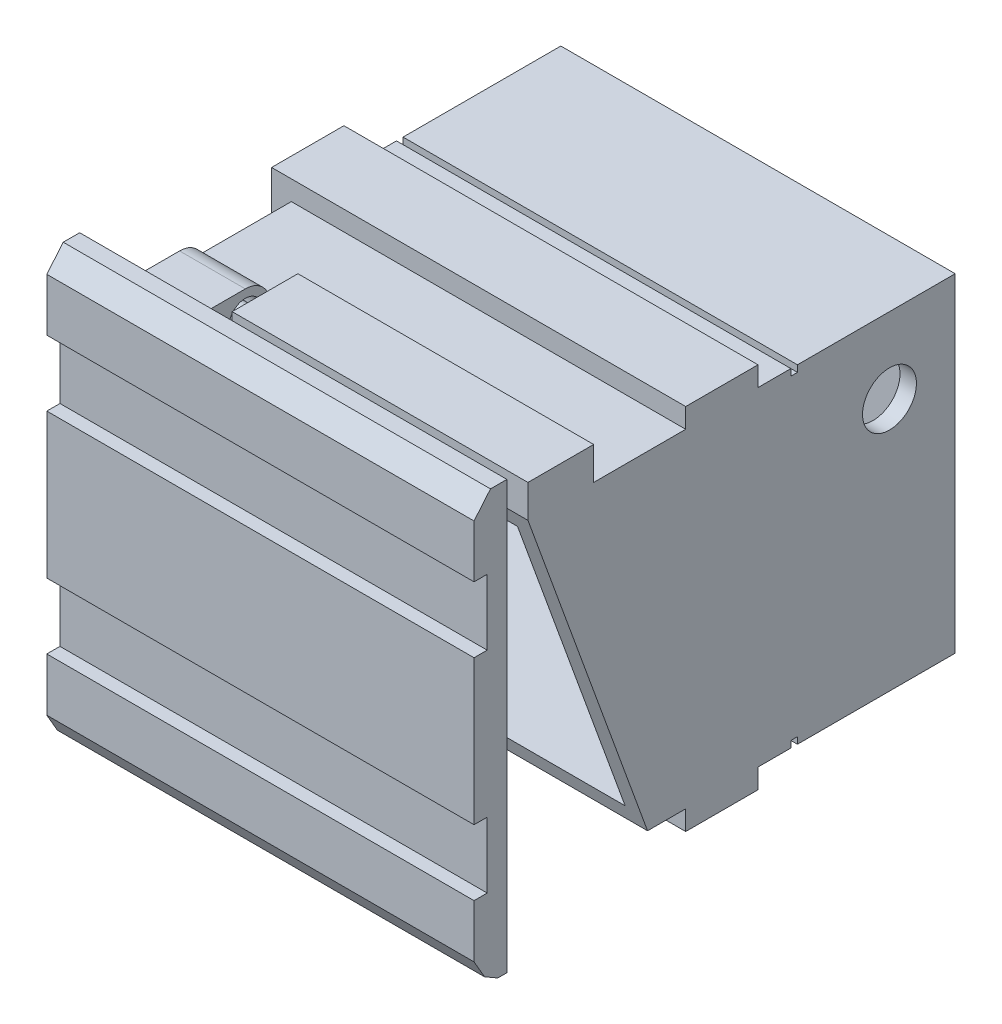
from build123d import *

# Parameters (mm, degrees)
CROQUIS2_W               = 60
CROQUIS2_H               = 50
SALIENTE_EXTRUIR2_DEPTH  = 5
CROQUIS3_W               = 60
CROQUIS3_H               = 50
CROQUIS3_W_2             = 55
CROQUIS3_H_2             = 45
SALIENTE_EXTRUIR3_DEPTH  = 60
CROQUIS4_R               = 4.1
CORTAR_EXTRUIR2_DEPTH    = 5
CORTAR_EXTRUIR3_DEPTH    = 92.923881554
CROQUIS18_W              = 11
CROQUIS18_H              = 50
SALIENTE_EXTRUIR10_DEPTH = 3
CROQUIS19_W              = 63
CROQUIS19_H              = 11
SALIENTE_EXTRUIR11_DEPTH = 3
CROQUIS20_W              = 63
CROQUIS20_H              = 11
SALIENTE_EXTRUIR12_DEPTH = 3
CROQUIS21_W              = 1
CROQUIS21_H              = 1
CORTAR_EXTRUIR8_DEPTH    = 65
CROQUIS23_W              = 1
CROQUIS23_H              = 1
CORTAR_EXTRUIR10_DEPTH   = 65
CROQUIS22_W              = 1
CROQUIS22_H              = 1
CORTAR_EXTRUIR9_DEPTH    = 65
CROQUIS29_W              = 45
CROQUIS29_H              = 10
SALIENTE_EXTRUIR13_DEPTH = 5
CROQUIS30_W              = 12.5
CROQUIS30_H              = 10
CORTAR_EXTRUIR11_DEPTH   = 3
CROQUIS31_R              = 1.5
SALIENTE_EXTRUIR14_DEPTH = 11.5
CROQUIS32_R              = 2.5
SALIENTE_EXTRUIR15_DEPTH = 12
CROQUIS33_W              = 15
CROQUIS33_H              = 9.46236556
CROQUIS33_R              = 1.5
CORTAR_EXTRUIR12_DEPTH   = 2
CROQUIS34_W              = 65
CROQUIS34_H              = 65
SALIENTE_EXTRUIR16_DEPTH = 5
CORTAR_EXTRUIR13_DEPTH   = 65
CORTAR_EXTRUIR14_DEPTH   = 65
CROQUIS38_W              = 2
CROQUIS38_H              = 10
CORTAR_EXTRUIR15_DEPTH   = 65


with BuildPart() as part:
    # Croquis2 → Saliente-Extruir2 (new body)
    with BuildSketch(Plane.XY):
        Rectangle(CROQUIS2_W, CROQUIS2_H)
    extrude(amount=SALIENTE_EXTRUIR2_DEPTH)

    # Croquis3 → Saliente-Extruir3 (add)
    with BuildSketch(Plane.XY.offset(5)):
        Rectangle(CROQUIS3_W, CROQUIS3_H)
        Rectangle(CROQUIS3_W_2, CROQUIS3_H_2, mode=Mode.SUBTRACT)
    extrude(amount=SALIENTE_EXTRUIR3_DEPTH)

    # Croquis4 → Cortar-Extruir2 (cut)
    with BuildSketch(Plane(origin=(30, 0, 0), x_dir=(0, 0, -1), z_dir=(1, 0, 0))):
        with Locations(Location((-10, 13.5, 0), (0, 0, 90))):
            Circle(CROQUIS4_R)
    extrude(amount=-CORTAR_EXTRUIR2_DEPTH, mode=Mode.SUBTRACT)

    # Croquis5 → Cortar-Extruir3 (cut, through all)
    with BuildSketch(Plane(origin=(30, 0, 0), x_dir=(0, 0, -1), z_dir=(1, 0, 0))):
        Polygon((-65, 25), (-46.801488287, -25), (-65, -25), align=None)
    extrude(amount=-CORTAR_EXTRUIR3_DEPTH, mode=Mode.SUBTRACT)

    # Croquis18 → Saliente-Extruir10 (add)
    with BuildSketch(Plane.ZY.offset(30)):
        with Locations((35.5, 0)):
            Rectangle(CROQUIS18_W, CROQUIS18_H)
    extrude(amount=SALIENTE_EXTRUIR10_DEPTH)

    # Croquis19 → Saliente-Extruir11 (add)
    with BuildSketch(Plane.XZ.offset(25)):
        with Locations((-1.5, 35.5)):
            Rectangle(CROQUIS19_W, CROQUIS19_H)
    extrude(amount=SALIENTE_EXTRUIR11_DEPTH)

    # Croquis20 → Saliente-Extruir12 (add)
    with BuildSketch(Plane(origin=(0, 25, 0), x_dir=(1, 0, 0), z_dir=(0, 1, 0))):
        with Locations((-1.5, -35.5)):
            Rectangle(CROQUIS20_W, CROQUIS20_H)
    extrude(amount=SALIENTE_EXTRUIR12_DEPTH)

    # Croquis21 → Cortar-Extruir8 (cut)
    with BuildSketch(Plane(origin=(30, 0, 0), x_dir=(0, 0, -1), z_dir=(1, 0, 0))):
        with Locations((-24.5, -24.5)):
            Rectangle(CROQUIS21_W, CROQUIS21_H)
    extrude(amount=-CORTAR_EXTRUIR8_DEPTH, mode=Mode.SUBTRACT)

    # Croquis23 → Cortar-Extruir10 (cut)
    with BuildSketch(Plane(origin=(30, 0, 0), x_dir=(0, 0, -1), z_dir=(1, 0, 0))):
        with Locations((-24.5, 24.5)):
            Rectangle(CROQUIS23_W, CROQUIS23_H)
    extrude(amount=-CORTAR_EXTRUIR10_DEPTH, mode=Mode.SUBTRACT)

    # Croquis22 → Cortar-Extruir9 (cut)
    with BuildSketch(Plane(origin=(0, 25, 0), x_dir=(1, 0, 0), z_dir=(0, 1, 0))):
        with Locations((-29.5, -24.5)):
            Rectangle(CROQUIS22_W, CROQUIS22_H)
    extrude(amount=-CORTAR_EXTRUIR9_DEPTH, mode=Mode.SUBTRACT)

    # Croquis29 → Saliente-Extruir13 (add)
    with BuildSketch(Plane(origin=(0, 25, 0), x_dir=(1, 0, 0), z_dir=(0, 1, 0))):
        with Locations((7.5, -60)):
            Rectangle(CROQUIS29_W, CROQUIS29_H)
    extrude(amount=SALIENTE_EXTRUIR13_DEPTH)

    # Croquis30 → Cortar-Extruir11 (cut)
    with BuildSketch(Plane(origin=(0, 25, 0), x_dir=(1, 0, 0), z_dir=(0, 1, 0))):
        with Locations((-21.25, -60)):
            Rectangle(CROQUIS30_W, CROQUIS30_H)
    extrude(amount=-CORTAR_EXTRUIR11_DEPTH, mode=Mode.SUBTRACT)

    # Croquis31 → Saliente-Extruir14 (add)
    with BuildSketch(Plane.ZY.offset(15)):
        with Locations(Location((61, 26.25, 0), (0, 0, 180))):
            Circle(CROQUIS31_R)
    extrude(amount=SALIENTE_EXTRUIR14_DEPTH)

    # Croquis32 → Saliente-Extruir15 (add)
    with BuildSketch(Plane.ZY.offset(15)):
        with BuildLine():
            Line((61, 30), (68.2, 30))
            Line((68.2, 30), (68.2, 22.5))
            Line((68.2, 22.5), (61, 22.5))
            ThreePointArc((61, 22.5), (57.25, 26.25), (61, 30))
        make_face()
        with Locations((61, 26.25)):
            Circle(CROQUIS32_R, mode=Mode.SUBTRACT)
    extrude(amount=SALIENTE_EXTRUIR15_DEPTH)

    # Croquis33 → Cortar-Extruir12 (cut)
    with BuildSketch(Plane.ZY.offset(15)):
        with Locations((62.5, 27.23118278)):
            Rectangle(CROQUIS33_W, CROQUIS33_H)
        with Locations(Location((61, 26.25, 0), (0, 0, 180))):
            Circle(CROQUIS33_R, mode=Mode.SUBTRACT)
    extrude(amount=CORTAR_EXTRUIR12_DEPTH, mode=Mode.SUBTRACT)


with BuildPart() as cortar_extruir12_piece_1:
    # of the separate pieces the step leaves, piece 1, a body of its own (cortar_extruir12_pieces)
    add(part.part.solids().sort_by_distance((-30, 25, 0))[0])


with BuildPart() as cortar_extruir12_piece_2:
    # of the separate pieces the step leaves, piece 2, a body of its own (cortar_extruir12_pieces)
    add(part.part.solids().sort_by_distance((-17, 30, 61))[0])

    # Croquis34 → Saliente-Extruir16 (add)
    with BuildSketch(Plane.XY.offset(68.2)):
        with Locations((-2.5, -0.5)):
            Rectangle(CROQUIS34_W, CROQUIS34_H)
    extrude(amount=SALIENTE_EXTRUIR16_DEPTH)

    # Croquis36 → Cortar-Extruir13 (cut)
    with BuildSketch(Plane(origin=(30, 0, 0), x_dir=(0, 0, -1), z_dir=(1, 0, 0))):
        Polygon((-70.7, 32), (-73.2, 29.020616019), (-73.2, 32), align=None)
    extrude(amount=-CORTAR_EXTRUIR13_DEPTH, mode=Mode.SUBTRACT)

    # Croquis37 → Cortar-Extruir14 (cut)
    with BuildSketch(Plane(origin=(30, 0, 0), x_dir=(0, 0, -1), z_dir=(1, 0, 0))):
        Polygon((-69.58947368, -33), (-71.601679744, -31.838252288), (-73.2, -29.069880397), (-73.2, -33), align=None)
    extrude(amount=-CORTAR_EXTRUIR14_DEPTH, mode=Mode.SUBTRACT)

    # Croquis38 → Cortar-Extruir15 (cut)
    with BuildSketch(Plane.ZY.offset(35)):
        with Locations((72.2, -16)):
            Rectangle(CROQUIS38_W, CROQUIS38_H)
        with Locations((72.2, 16)):
            Rectangle(CROQUIS38_W, CROQUIS38_H)
    extrude(amount=-CORTAR_EXTRUIR15_DEPTH, mode=Mode.SUBTRACT)


solid = Compound([cortar_extruir12_piece_1.part, cortar_extruir12_piece_2.part])
